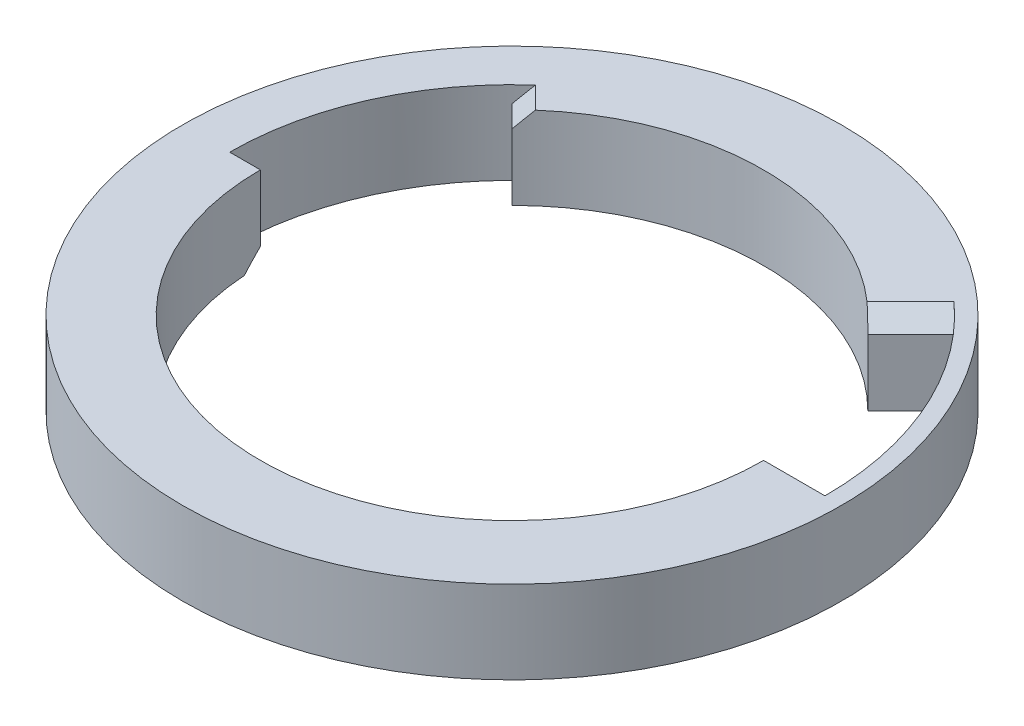
from build123d import *

# Parameters (mm, degrees)
SKETCH1_R           = 39.75
BOSS_EXTRUDE1_DEPTH = 10
CUT_EXTRUDE4_DEPTH  = 10
CHAMFER1_SIZE       = 2
CHAMFER2_SIZE       = 2
CHAMFER3_SIZE       = 2
CHAMFER4_SIZE       = 2


with BuildPart() as part:
    # Sketch1 → Boss-Extrude1 (new body)
    with BuildSketch(Plane(origin=(0, 0, 0), x_dir=(1, 0, 0), z_dir=(0, 1, 0))):
        with Locations(Location((0, 0, 0), (0, 0, 270))):
            Circle(SKETCH1_R)
    extrude(amount=BOSS_EXTRUDE1_DEPTH)

    # Sketch2 → Cut-Extrude4 (cut)
    with BuildSketch(Plane(origin=(0, 10, 0), x_dir=(1, 0, 0), z_dir=(0, 1, 0))):
        with BuildLine():
            Line((30.35, 0), (37.75, 0))
            ThreePointArc((37.75, 0), (34.876452352, 14.446299572), (26.69328099, 26.69328099))
            Line((26.69328099, 26.69328099), (21.460690809, 21.460690809))
            ThreePointArc((21.460690809, 21.460690809), (0, 30.35), (-21.460690809, 21.460690809))
            Line((-21.460690809, 21.460690809), (-24.076985899, 24.076985899))
            ThreePointArc((-24.076985899, 24.076985899), (-31.458098082, 13.030370872), (-34.05, 0))
            Line((-34.05, 0), (-30.35, 0))
            ThreePointArc((-30.35, 0), (0, -30.35), (30.35, 0))
        make_face()
    extrude(amount=-CUT_EXTRUDE4_DEPTH, mode=Mode.SUBTRACT)

    # Chamfer1
    chamfer1_edges = [part.edges().sort_by_distance(p)[0] for p in [
        (34.05, 0, 0),
    ]]
    chamfer(chamfer1_edges, length=CHAMFER1_SIZE)

    # Chamfer2
    chamfer2_edges = [part.edges().sort_by_distance(p)[0] for p in [
        (-32.2, 0, 0),
    ]]
    chamfer(chamfer2_edges, length=CHAMFER2_SIZE)

    # Chamfer3
    chamfer3_edges = [part.edges().sort_by_distance(p)[0] for p in [
        (24.076985899, 10, -24.076985899),
    ]]
    chamfer(chamfer3_edges, length=CHAMFER3_SIZE)

    # Chamfer4
    chamfer4_edges = [part.edges().sort_by_distance(p)[0] for p in [
        (-22.768838354, 10, -22.768838354),
    ]]
    chamfer(chamfer4_edges, length=CHAMFER4_SIZE)


solid = part.part
